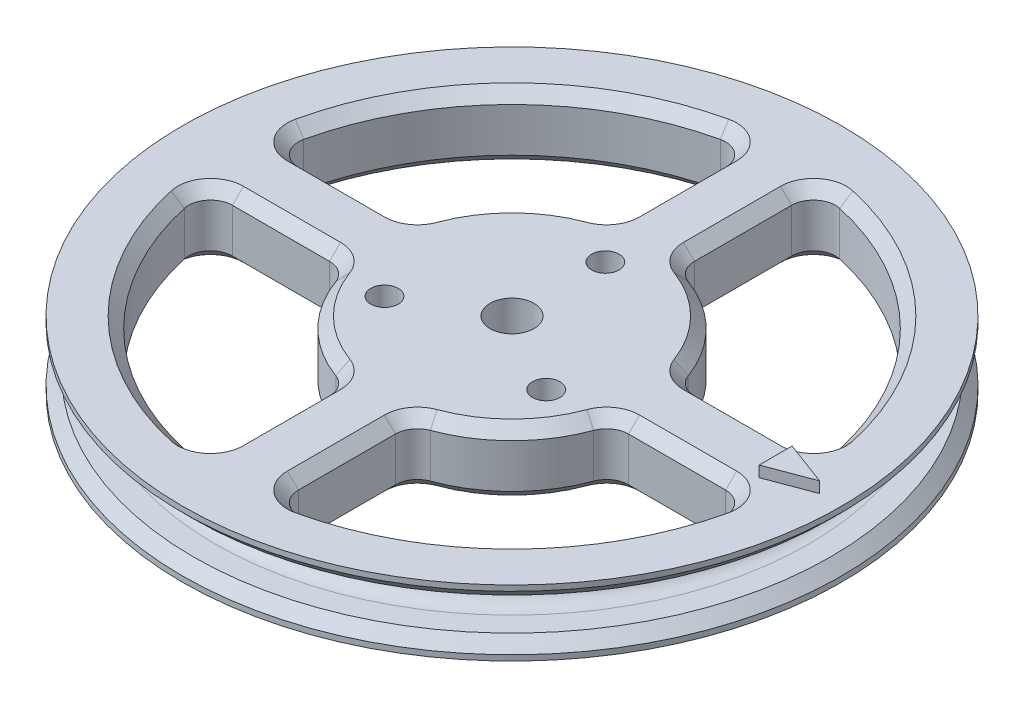
from build123d import *

# Parameters (mm, degrees)
SKETCH1_R             = 30
SKETCH1_R_2           = 2
BOSS_EXTRUDE1_DEPTH   = 6
M3X0_5_TAPPED_HOLE1_D = 2.5
CHAMFER1_SIZE         = 1
BOSS_EXTRUDE2_DEPTH   = 1


with BuildPart() as part:
    # Sketch1 → Boss-Extrude1 (new body)
    with BuildSketch(Plane(origin=(0, 0, 0), x_dir=(1, 0, 0), z_dir=(0, 1, 0))):
        with Locations(Location((0, 0, 0), (0, 0, 270))):
            Circle(SKETCH1_R)
        with Locations(Location((0, 0, 0), (0, 0, 270))):
            Circle(SKETCH1_R_2, mode=Mode.SUBTRACT)
        with BuildLine():
            Line((-22.449944321, -3), (-13.610657589, -3))
            ThreePointArc((-13.610657589, -3), (-12.465954646, -3.359983179), (-11.733325508, -4.310344828))
            ThreePointArc((-11.733325508, -4.310344828), (-8.838834765, -8.838834765), (-4.310344828, -11.733325508))
            ThreePointArc((-4.310344828, -11.733325508), (-3.359983179, -12.465954646), (-3, -13.610657589))
            Line((-3, -13.610657589), (-3, -22.449944321))
            ThreePointArc((-3, -22.449944321), (-3.748913516, -24.010323316), (-5.434782609, -24.402113392))
            ThreePointArc((-5.434782609, -24.402113392), (-17.67766953, -17.67766953), (-24.402113392, -5.434782609))
            ThreePointArc((-24.402113392, -5.434782609), (-24.010323316, -3.748913516), (-22.449944321, -3))
        make_face(mode=Mode.SUBTRACT)
        with BuildLine():
            Line((3, -22.449944321), (3, -13.610657589))
            ThreePointArc((3, -13.610657589), (3.359983179, -12.465954646), (4.310344828, -11.733325508))
            ThreePointArc((4.310344828, -11.733325508), (8.838834765, -8.838834765), (11.733325508, -4.310344828))
            ThreePointArc((11.733325508, -4.310344828), (12.465954646, -3.359983179), (13.610657589, -3))
            Line((13.610657589, -3), (22.449944321, -3))
            ThreePointArc((22.449944321, -3), (24.010323316, -3.748913516), (24.402113392, -5.434782609))
            ThreePointArc((24.402113392, -5.434782609), (17.67766953, -17.67766953), (5.434782609, -24.402113392))
            ThreePointArc((5.434782609, -24.402113392), (3.748913516, -24.010323316), (3, -22.449944321))
        make_face(mode=Mode.SUBTRACT)
        with BuildLine():
            Line((22.449944321, 3), (13.610657589, 3))
            ThreePointArc((13.610657589, 3), (12.465954646, 3.359983179), (11.733325508, 4.310344828))
            ThreePointArc((11.733325508, 4.310344828), (8.838834765, 8.838834765), (4.310344828, 11.733325508))
            ThreePointArc((4.310344828, 11.733325508), (3.359983179, 12.465954646), (3, 13.610657589))
            Line((3, 13.610657589), (3, 22.449944321))
            ThreePointArc((3, 22.449944321), (3.748913516, 24.010323316), (5.434782609, 24.402113392))
            ThreePointArc((5.434782609, 24.402113392), (17.67766953, 17.67766953), (24.402113392, 5.434782609))
            ThreePointArc((24.402113392, 5.434782609), (24.010323316, 3.748913516), (22.449944321, 3))
        make_face(mode=Mode.SUBTRACT)
        with BuildLine():
            Line((-3, 22.449944321), (-3, 13.610657589))
            ThreePointArc((-3, 13.610657589), (-3.359983179, 12.465954646), (-4.310344828, 11.733325508))
            ThreePointArc((-4.310344828, 11.733325508), (-8.838834765, 8.838834765), (-11.733325508, 4.310344828))
            ThreePointArc((-11.733325508, 4.310344828), (-12.465954646, 3.359983179), (-13.610657589, 3))
            Line((-13.610657589, 3), (-22.449944321, 3))
            ThreePointArc((-22.449944321, 3), (-24.010323316, 3.748913516), (-24.402113392, 5.434782609))
            ThreePointArc((-24.402113392, 5.434782609), (-17.67766953, 17.67766953), (-5.434782609, 24.402113392))
            ThreePointArc((-5.434782609, 24.402113392), (-3.748913516, 24.010323316), (-3, 22.449944321))
        make_face(mode=Mode.SUBTRACT)
    extrude(amount=BOSS_EXTRUDE1_DEPTH)

    # M3x0.5 Tapped Hole1 (through all)
    with Locations(Plane(origin=(0, 6, 0), x_dir=(1, 0, 0), z_dir=(0, 1, 0))):
        with Locations((-7.361215932, -4.25), (0, 8.5), (7.361215932, -4.25)):
            Hole(M3X0_5_TAPPED_HOLE1_D / 2)

    # Sketch5 → Cut-Revolve1 (revolve, cut)
    with BuildSketch(Plane(origin=(0, 0, 0), x_dir=(0, 0, -1), z_dir=(1, 0, 0)), mode=Mode.PRIVATE) as cut_revolve1_sk:
        with BuildLine():
            Line((-30, 4.5), (-27, 4.5))
            ThreePointArc((-27, 4.5), (-25.5, 3), (-27, 1.5))
            Line((-27, 1.5), (-30, 1.5))
            Line((-30, 1.5), (-30, 4.5))
        make_face()
    revolve(cut_revolve1_sk.sketch.rotate(Axis((0, 0, 0), (0, 1, 0)), 180), axis=Axis((0, 0, 0), (0, 1, 0)), mode=Mode.SUBTRACT)

    # Chamfer1
    chamfer1_edges = [part.edges().sort_by_distance(p)[0] for p in [
        (0, 4.5, -30),
        (0, 1.5, -30),
        (-12.465954646, 0, 3.359983179),
        (-18.030300955, 0, 3),
        (-24.010323316, 0, 3.748913516),
        (-17.67766953, 0, 17.67766953),
        (-3.748913516, 0, 24.010323316),
        (-3, 0, 18.030300955),
        (-3.359983179, 0, 12.465954646),
        (-8.838834765, 0, 8.838834765),
        (-12.465954646, 6, 3.359983179),
        (-18.030300955, 6, 3),
        (-24.010323316, 6, 3.748913516),
        (-17.67766953, 6, 17.67766953),
        (-3.748913516, 6, 24.010323316),
        (-3, 6, 18.030300955),
        (-3.359983179, 6, 12.465954646),
        (-8.838834765, 6, 8.838834765),
        (24.010323316, 0, 3.748913516),
        (18.030300955, 0, 3),
        (12.465954646, 0, 3.359983179),
        (8.838834765, 0, 8.838834765),
        (3.359983179, 0, 12.465954646),
        (3, 0, 18.030300955),
        (3.748913516, 0, 24.010323316),
        (17.67766953, 0, 17.67766953),
        (24.010323316, 6, 3.748913516),
        (18.030300955, 6, 3),
        (12.465954646, 6, 3.359983179),
        (8.838834765, 6, 8.838834765),
        (3.359983179, 6, 12.465954646),
        (3, 6, 18.030300955),
        (3.748913516, 6, 24.010323316),
        (17.67766953, 6, 17.67766953),
        (17.67766953, 0, -17.67766953),
        (3.748913516, 0, -24.010323316),
        (3, 0, -18.030300955),
        (3.359983179, 0, -12.465954646),
        (8.838834765, 0, -8.838834765),
        (12.465954646, 0, -3.359983179),
        (18.030300955, 0, -3),
        (24.010323316, 0, -3.748913516),
        (17.67766953, 6, -17.67766953),
        (3.748913516, 6, -24.010323316),
        (3, 6, -18.030300955),
        (3.359983179, 6, -12.465954646),
        (8.838834765, 6, -8.838834765),
        (12.465954646, 6, -3.359983179),
        (18.030300955, 6, -3),
        (24.010323316, 6, -3.748913516),
        (-24.010323316, 0, -3.748913516),
        (-18.030300955, 0, -3),
        (-12.465954646, 0, -3.359983179),
        (-8.838834765, 0, -8.838834765),
        (-3.359983179, 0, -12.465954646),
        (-3, 0, -18.030300955),
        (-3.748913516, 0, -24.010323316),
        (-17.67766953, 0, -17.67766953),
        (-24.010323316, 6, -3.748913516),
        (-18.030300955, 6, -3),
        (-12.465954646, 6, -3.359983179),
        (-8.838834765, 6, -8.838834765),
        (-3.359983179, 6, -12.465954646),
        (-3, 6, -18.030300955),
        (-3.748913516, 6, -24.010323316),
        (-17.67766953, 6, -17.67766953),
    ]]
    chamfer(chamfer1_edges, length=CHAMFER1_SIZE)

    # Sketch6 → Boss-Extrude2 (add)
    with BuildSketch(Plane(origin=(0, 6, 0), x_dir=(1, 0, 0), z_dir=(0, 1, 0))):
        Polygon((24, -1.5), (24, 1.5), (28, 0), align=None)
    extrude(amount=BOSS_EXTRUDE2_DEPTH)


solid = part.part
